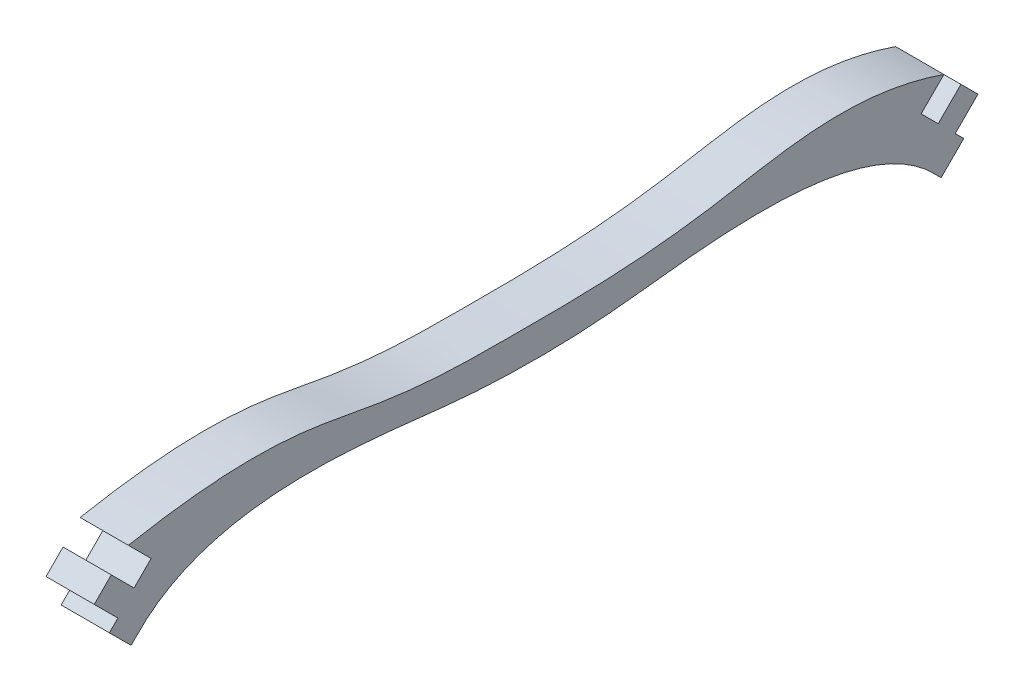
from build123d import *

# Parameters (mm, degrees)
ESTRUSIONE_ESTRUSIONE1_DEPTH = 6


with BuildPart() as part:
    # Schizzo1 → Estrusione-Estrusione1 (new body)
    with BuildSketch(Plane(origin=(0, 0, 0), x_dir=(0, 0, -1), z_dir=(1, 0, 0))):
        with BuildLine():
            Line((-54.949747468, -4.949747468), (-52.828427125, -2.828427125))
            Line((-52.828427125, -2.828427125), (-50, -5.656854249))
            Line((-50, -5.656854249), (-47.878679656, -3.535533906))
            Line((-47.878679656, -3.535533906), (-50.707106781, -0.707106781))
            add(Edge.make_bspline(
                [(-50.707106781, -0.707106781), (-34.940891697, 2.276271887), (-17.588095178, -2.006317394), (-8.15045286, -1.973714009), (7.039741041, -2.027945044), (22.77573383, -1.214378117), (39.305531053, 3.253874033), (50.707106781, -0.707106781)],
                knots=[0, 0, 0, 0, 0.188415067, 0.445999155, 0.506836248, 0.735948909, 1, 1, 1, 1], degree=3))
            Line((50.707106781, -0.707106781), (47.878679656, -3.535533906))
            Line((47.878679656, -3.535533906), (50, -5.656854249))
            Line((50, -5.656854249), (52.828427125, -2.828427125))
            Line((52.828427125, -2.828427125), (54.949747468, -4.949747468))
            Line((54.949747468, -4.949747468), (52.121320344, -7.778174593))
            Line((52.121320344, -7.778174593), (53.181980515, -8.838834765))
            Line((53.181980515, -8.838834765), (50.364612745, -11.656202535))
            Line((50.364612745, -11.656202535), (49.657505964, -10.949095754))
            add(Edge.make_bspline(
                [(-49.657505964, -10.949095754), (-42.297875545, -3.213884189), (-21.591673469, -3.850484781), (-7.81090535, -6.008179807), (7.81090535, -6.008179807), (21.591673469, -3.850484781), (42.297875545, -3.213884189), (49.657505964, -10.949095754)],
                knots=[0, 0, 0, 0, 0.322683239, 0.480298138, 0.519701862, 0.677316761, 1, 1, 1, 1], degree=3))
            Line((-49.657505964, -10.949095754), (-50.364612745, -11.656202535))
            Line((-50.364612745, -11.656202535), (-53.06846134, -8.95235394))
            Line((-53.06846134, -8.95235394), (-52.007801168, -7.891693768))
            Line((-52.007801168, -7.891693768), (-54.949747468, -4.949747468))
        make_face()
    extrude(amount=ESTRUSIONE_ESTRUSIONE1_DEPTH)


solid = part.part
